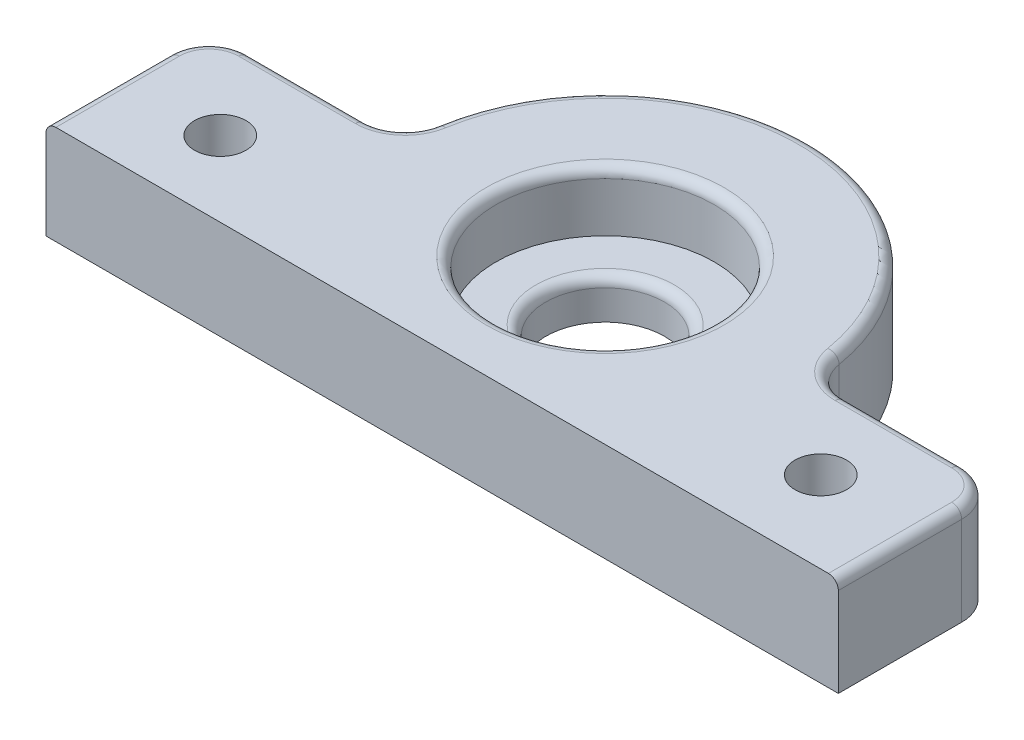
from build123d import *

# Parameters (mm, degrees)
SKETCH1_R           = 11.025
BOSS_EXTRUDE1_DEPTH = 10
SKETCH3_R           = 11.025
SKETCH3_R_2         = 6
BOSS_EXTRUDE2_DEPTH = 4
FILLET1_R           = 4
FILLET2_R           = 1
CUT_EXTRUDE1_REACH  = 48.068
SKETCH4_R           = 2.6


with BuildPart() as part:
    # Sketch1 → Boss-Extrude1 (new body)
    with BuildSketch(Plane(origin=(0, 0, 0), x_dir=(1, 0, 0), z_dir=(0, 1, 0))):
        with BuildLine():
            Line((-40, -16.45412), (40, -16.45412))
            Line((40, -16.45412), (40, 0))
            Line((40, 0), (20.55, 0))
            ThreePointArc((20.55, 0), (0, 20.55), (-20.55, 0))
            Line((-20.55, 0), (-40, 0))
            Line((-40, 0), (-40, -16.45412))
        make_face()
        with Locations(Location((0, 0, 0), (0, 0, 270))):
            Circle(SKETCH1_R, mode=Mode.SUBTRACT)
    extrude(amount=BOSS_EXTRUDE1_DEPTH)

    # Sketch3 → Boss-Extrude2 (add)
    with BuildSketch(Plane.XZ):
        with Locations(Location((0, 0, 0), (0, 0, 270))):
            Circle(SKETCH3_R)
        with Locations(Location((0, 0, 0), (0, 0, 270))):
            Circle(SKETCH3_R_2, mode=Mode.SUBTRACT)
    extrude(amount=-BOSS_EXTRUDE2_DEPTH)

    # Fillet1
    fillet1_edges = [part.edges().sort_by_distance(p)[0] for p in [
        (-40, 5, 0),
        (-20.55, 5, 0),
        (20.55, 5, 0),
        (40, 5, 0),
    ]]
    fillet(fillet1_edges, radius=FILLET1_R)

    # Fillet2
    fillet2_edges = [part.edges().sort_by_distance(p)[0] for p in [
        (40, 10, 10.22706),
        (0, 10, -11.025),
        (0, 4, 6),
        (-40, 10, 10.22706),
        (-30.110971266, 10, 0),
        (30.110971266, 10, 0),
        (0, 10, -20.55),
        (38.828427125, 10, 1.171572875),
        (-38.828427125, 10, 1.171572875),
        (-21.634175603, 10, -0.949842246),
        (21.634175603, 10, -0.949842246),
    ]]
    fillet(fillet2_edges, radius=FILLET2_R)

    # Sketch4 → Cut-Extrude1 (cut, up to next)
    with BuildSketch(Plane.XZ, mode=Mode.PRIVATE) as cut_extrude1_sk1:
        with Locations(Location((30, 8.22706, 0), (0, 0, 270))):
            Circle(SKETCH4_R)
    cut_extrude1_tool1 = extrude(cut_extrude1_sk1.sketch, amount=-CUT_EXTRUDE1_REACH, mode=Mode.PRIVATE) & part.part
    # Sketch4 → Cut-Extrude1 (cut, up to next)
    with BuildSketch(Plane.XZ, mode=Mode.PRIVATE) as cut_extrude1_sk2:
        with Locations(Location((-29.996640074, 8.862024441, 0), (0, 0, 270))):
            Circle(SKETCH4_R)
    cut_extrude1_tool2 = extrude(cut_extrude1_sk2.sketch, amount=-CUT_EXTRUDE1_REACH, mode=Mode.PRIVATE) & part.part
    add(cut_extrude1_tool1.solids().sort_by_distance((30, 0, 8.22706))[0], mode=Mode.SUBTRACT)
    add(cut_extrude1_tool2.solids().sort_by_distance((-29.99664, 0, 8.862024))[0], mode=Mode.SUBTRACT)


solid = part.part
